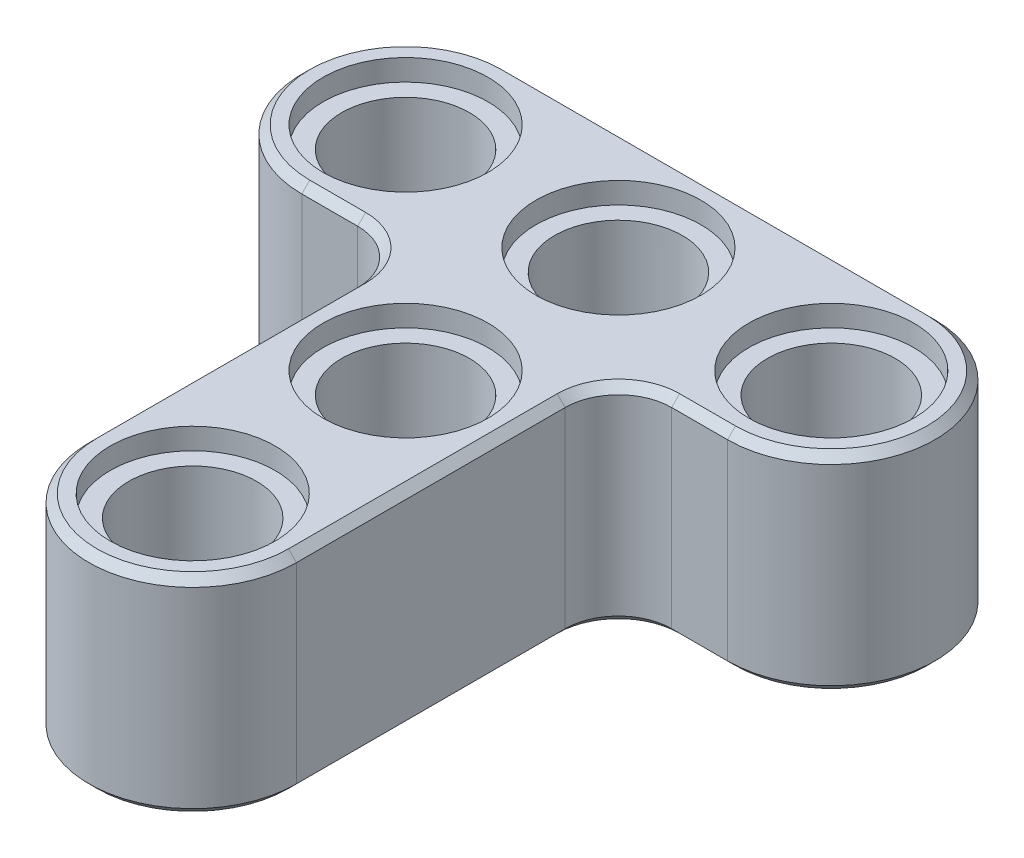
from build123d import *

# Parameters (mm, degrees)
BOSS_EXTRUDE1_DEPTH           = 3.9
SKETCH2_R                     = 2.4
CUT_EXTRUDE1_DEPTH            = 25.463442113
SKETCH3_R                     = 3.1
CUT_EXTRUDE2_DEPTH            = 0.8
LPATTERN1_COUNT               = 2
LPATTERN1_PITCH               = 8
LPATTERN1_COPY_1_SKETCH_R     = 3.1
LPATTERN1_COPY_1_DEPTH        = 0.8
LPATTERN1_COL_COUNT           = 2
LPATTERN1_COL_PITCH           = 8
LPATTERN1_COL_COPY_1_SKETCH_R = 3.1
LPATTERN1_COL_COPY_1_DEPTH    = 0.8
LPATTERN2_COUNT               = 3
LPATTERN2_PITCH               = 8
LPATTERN2_COPY_1_SKETCH_R     = 3.1
LPATTERN2_COPY_1_DEPTH        = 0.8
LPATTERN2_COPY_2_SKETCH_R     = 3.1
LPATTERN2_COPY_2_DEPTH        = 0.8
FILLET1_R                     = 2
CHAMFER1_SIZE                 = 0.3


with BuildPart() as part:
    # Sketch1 → Boss-Extrude1 (new, symmetric)
    with BuildSketch(Plane(origin=(0, 0, 0), x_dir=(1, 0, 0), z_dir=(0, 1, 0))):
        with BuildLine():
            Line((-8, -3.9), (8, -3.9))
            ThreePointArc((8, -3.9), (11.9, 0), (8, 3.9))
            Line((8, 3.9), (-8, 3.9))
            ThreePointArc((-8, 3.9), (-11.9, 0), (-8, -3.9))
        make_face()
        with BuildLine():
            Line((-3.9, 0), (-3.9, -16))
            ThreePointArc((-3.9, -16), (0, -19.9), (3.9, -16))
            Line((3.9, -16), (3.9, 0))
            ThreePointArc((3.9, 0), (0, 3.9), (-3.9, 0))
        make_face()
    extrude(amount=BOSS_EXTRUDE1_DEPTH, both=True)

    # Sketch2 → Cut-Extrude1 (cut, through all)
    with BuildSketch(Plane(origin=(0, 3.9, 0), x_dir=(1, 0, 0), z_dir=(0, 1, 0))):
        with Locations(Location((0, 0, 0), (0, 0, 270))):
            Circle(SKETCH2_R)
    cut_extrude1 = extrude(amount=-CUT_EXTRUDE1_DEPTH, mode=Mode.SUBTRACT)

    # Sketch3 → Cut-Extrude2 (cut)
    with BuildSketch(Plane(origin=(0, 3.9, 0), x_dir=(1, 0, 0), z_dir=(0, 1, 0))):
        with Locations(Location((0, 0, 0), (0, 0, 270))):
            Circle(SKETCH3_R)
    cut_extrude2 = extrude(amount=-CUT_EXTRUDE2_DEPTH, mode=Mode.SUBTRACT)

    # Mirror1: Cut-Extrude2 across plane
    add(cut_extrude2.mirror(Plane.ZX), mode=Mode.SUBTRACT)

    # LPattern1: Cut-Extrude1, Cut-Extrude2 ×2
    with Locations(*[(-i * LPATTERN1_PITCH, 0, 0) for i in range(1, LPATTERN1_COUNT)]):
        add(cut_extrude1, mode=Mode.SUBTRACT)
        add(cut_extrude2, mode=Mode.SUBTRACT)

    # LPattern1 copy 1 sketch → LPattern1 copy 1 (cut)
    with BuildSketch(Plane(origin=(-8, -3.9, 0), x_dir=(1, 0, 0), z_dir=(0, -1, 0))):
        Circle(LPATTERN1_COPY_1_SKETCH_R)
    extrude(amount=-LPATTERN1_COPY_1_DEPTH, mode=Mode.SUBTRACT)

    # LPattern1 col: Cut-Extrude1, Cut-Extrude2 ×2
    with Locations(*[(i * LPATTERN1_COL_PITCH, 0, 0) for i in range(1, LPATTERN1_COL_COUNT)]):
        add(cut_extrude1, mode=Mode.SUBTRACT)
        add(cut_extrude2, mode=Mode.SUBTRACT)

    # LPattern1 col copy 1 sketch → LPattern1 col copy 1 (cut)
    with BuildSketch(Plane(origin=(8, -3.9, 0), x_dir=(1, 0, 0), z_dir=(0, -1, 0))):
        Circle(LPATTERN1_COL_COPY_1_SKETCH_R)
    extrude(amount=-LPATTERN1_COL_COPY_1_DEPTH, mode=Mode.SUBTRACT)

    # LPattern2: Cut-Extrude1, Cut-Extrude2 ×3
    with Locations(*[(0, 0, i * LPATTERN2_PITCH) for i in range(1, LPATTERN2_COUNT)]):
        add(cut_extrude1, mode=Mode.SUBTRACT)
        add(cut_extrude2, mode=Mode.SUBTRACT)

    # LPattern2 copy 1 sketch → LPattern2 copy 1 (cut)
    with BuildSketch(Plane(origin=(0, -3.9, 8), x_dir=(1, 0, 0), z_dir=(0, -1, 0))):
        Circle(LPATTERN2_COPY_1_SKETCH_R)
    extrude(amount=-LPATTERN2_COPY_1_DEPTH, mode=Mode.SUBTRACT)

    # LPattern2 copy 2 sketch → LPattern2 copy 2 (cut)
    with BuildSketch(Plane(origin=(0, -3.9, 16), x_dir=(1, 0, 0), z_dir=(0, -1, 0))):
        Circle(LPATTERN2_COPY_2_SKETCH_R)
    extrude(amount=-LPATTERN2_COPY_2_DEPTH, mode=Mode.SUBTRACT)

    # Fillet1
    fillet1_edges = [part.edges().sort_by_distance(p)[0] for p in [
        (3.9, 0, 3.9),
        (-3.9, 0, 3.9),
    ]]
    fillet(fillet1_edges, radius=FILLET1_R)

    # Chamfer1
    chamfer1_edges = [part.edges().sort_by_distance(p)[0] for p in [
        (0, 3.9, 19.9),
        (-3.9, -3.9, 10.95),
        (-3.9, 3.9, 10.95),
        (3.9, -3.9, 10.95),
        (3.9, 3.9, 10.95),
        (6.95, -3.9, 3.9),
        (6.95, 3.9, 3.9),
        (-4.485786438, 3.9, 4.485786438),
        (-4.485786438, -3.9, 4.485786438),
        (4.485786438, 3.9, 4.485786438),
        (4.485786438, -3.9, 4.485786438),
        (-6.95, 3.9, 3.9),
        (11.9, 3.9, 0),
        (0, 3.9, -3.9),
        (-11.9, 3.9, 0),
        (-6.95, -3.9, 3.9),
        (11.9, -3.9, 0),
        (0, -3.9, -3.9),
        (-11.9, -3.9, 0),
        (0, -3.9, 19.9),
    ]]
    chamfer(chamfer1_edges, length=CHAMFER1_SIZE)


solid = part.part
